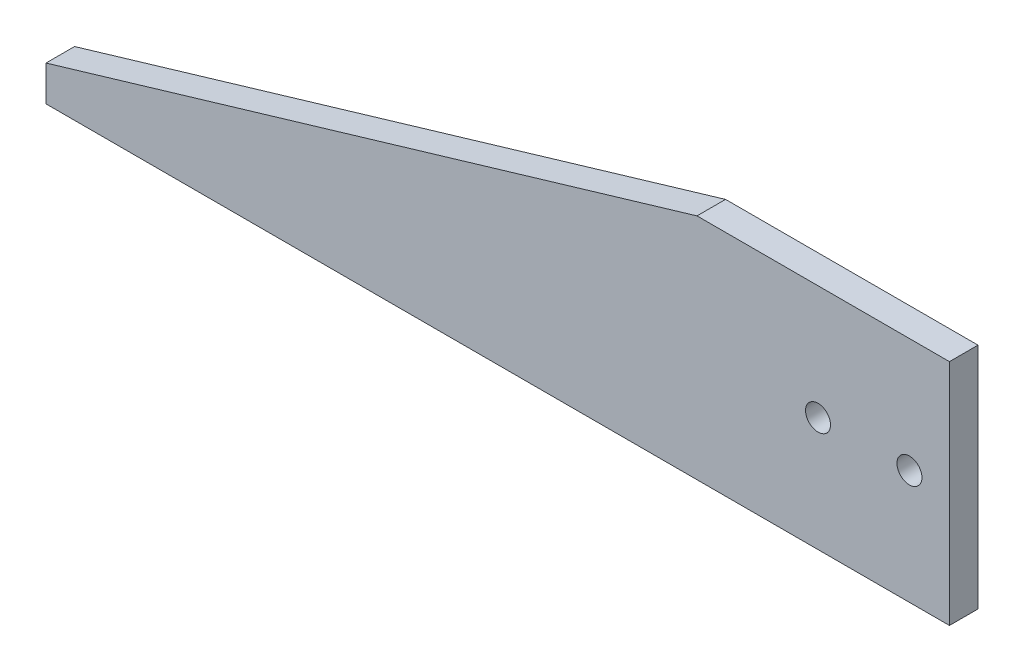
from build123d import *

# Parameters (mm, degrees)
BOSS_EXTRUDE1_DEPTH = 6.35
SKETCH2_R           = 2.778125
CUT_EXTRUDE1_DEPTH  = 208.258653961


with BuildPart() as part:
    # Sketch1 → Boss-Extrude1 (new body)
    with BuildSketch(Plane.XY):
        Polygon((0, 0), (0, 50.8), (-56.115509559, 50.8), (-200.836219696, 7.8694881), (-200.836219696, 0), align=None)
    extrude(amount=BOSS_EXTRUDE1_DEPTH)

    # Sketch2 → Cut-Extrude1 (cut, through all)
    with BuildSketch(Plane.XY.offset(6.35)):
        with Locations((-29.21, 25.4)):
            Circle(SKETCH2_R)
        with Locations((-8.89, 25.4)):
            Circle(SKETCH2_R)
    extrude(amount=-CUT_EXTRUDE1_DEPTH, mode=Mode.SUBTRACT)


solid = part.part
